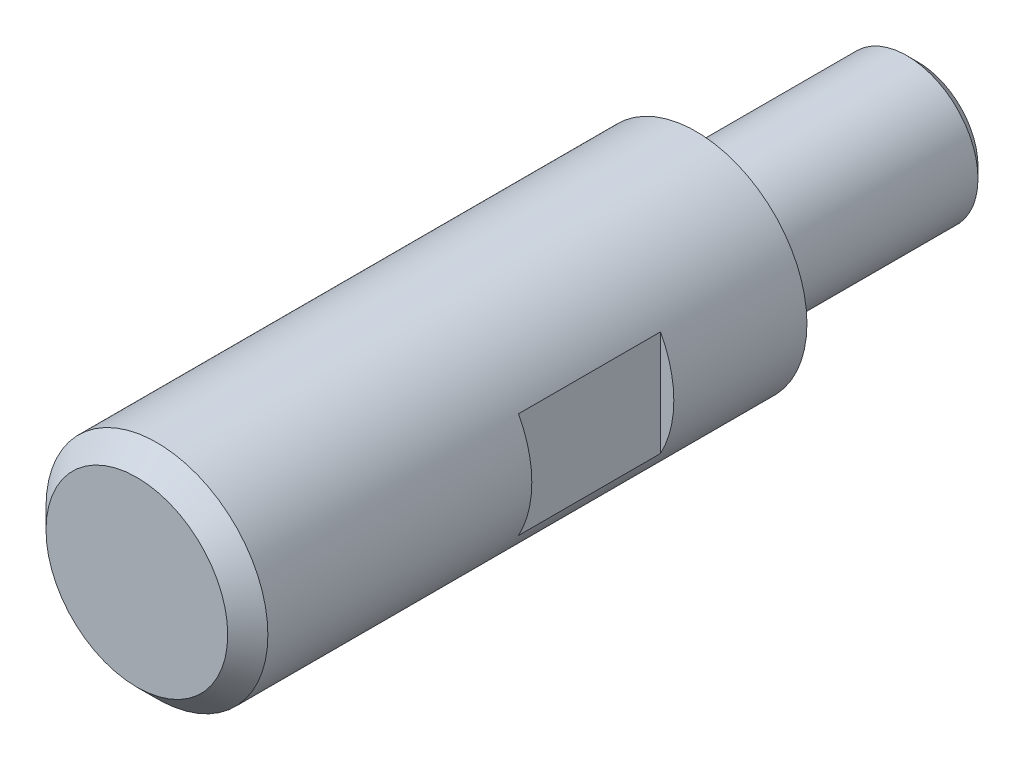
from build123d import *

# Parameters (mm, degrees)
SZKIC4_W                        = 63
SZKIC4_H                        = 12.5
WYTNIJ_WYCI_GNI_CIE1_DEPTH      = 12.5
WYTNIJ_WYCI_GNI_CIE1_DEPTH_BACK = 12.5
SZKIC1_W                        = 4
SZKIC1_H                        = 16
WYTNIJ_WYCI_GNI_CIE2_DEPTH      = 12.5
WYTNIJ_WYCI_GNI_CIE2_DEPTH_BACK = 12.5
SZKIC2_W                        = 4
SZKIC2_H                        = 16


with BuildPart() as part:
    # Szkic3 → Obrót1 (revolve)
    with BuildSketch(Plane(origin=(0, 0, 0), x_dir=(0, 0, -1), z_dir=(1, 0, 0))):
        Polygon((-25, 0), (-25, 8), (-1.227, 8), (0, 6.773), (0, 0), align=None)
    revolve(axis=Axis((0, 0, 0), (0, 0, 1)))

    # Szkic4 → Obrót2 (revolve)
    with BuildSketch(Plane(origin=(0, 0, 0), x_dir=(0, 0, -1), z_dir=(1, 0, 0))):
        with Locations((-56.5, 6.25)):
            Rectangle(SZKIC4_W, SZKIC4_H)
    revolve(axis=Axis((0, 0, 25), (0, 0, 1)))

    # Szkic5 → Wycięcie-obrót1 (revolve, cut)
    with BuildSketch(Plane(origin=(0, 0, 0), x_dir=(0, 0, -1), z_dir=(1, 0, 0))):
        Polygon((-88, 10.2372583), (-85.7372583, 12.5), (-88, 12.5), align=None)
    revolve(axis=Axis((0, 0, 25), (0, 0, 1)), mode=Mode.SUBTRACT)

    # Szkic6 → Wycięcie-obrót2 (revolve, cut)
    with BuildSketch(Plane(origin=(0, 0, 0), x_dir=(0, 0, -1), z_dir=(1, 0, 0))):
        with BuildLine():
            Line((-23.4, 8), (-25, 8))
            ThreePointArc((-25, 8), (-24.2, 7.2), (-23.4, 8))
        make_face()
    revolve(axis=Axis((0, 0, 0), (0, 0, 1)), mode=Mode.SUBTRACT)

    # Szkic1 → Wytnij-wyciągnięcie1 (cut, two sides: drawn at the far end of the back side and taken through both)
    with BuildSketch(Plane(origin=(0, 0, 0), x_dir=(1, 0, 0), z_dir=(0, 1, 0)).offset(-WYTNIJ_WYCI_GNI_CIE1_DEPTH_BACK)):
        with Locations((13, -48)):
            Rectangle(SZKIC1_W, SZKIC1_H)
    extrude(amount=WYTNIJ_WYCI_GNI_CIE1_DEPTH + WYTNIJ_WYCI_GNI_CIE1_DEPTH_BACK, mode=Mode.SUBTRACT)

    # Szkic2 → Wytnij-wyciągnięcie2 (cut, two sides: drawn at the far end of the back side and taken through both)
    with BuildSketch(Plane(origin=(0, 0, 0), x_dir=(1, 0, 0), z_dir=(0, 1, 0)).offset(-WYTNIJ_WYCI_GNI_CIE2_DEPTH_BACK)):
        with Locations((-13, -48)):
            Rectangle(SZKIC2_W, SZKIC2_H)
    extrude(amount=WYTNIJ_WYCI_GNI_CIE2_DEPTH + WYTNIJ_WYCI_GNI_CIE2_DEPTH_BACK, mode=Mode.SUBTRACT)


solid = part.part
